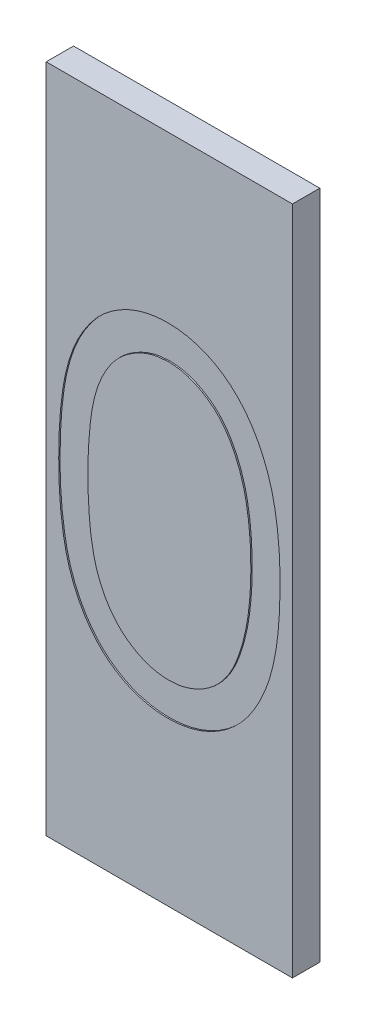
from build123d import *

# Parameters (mm, degrees)
SKETCH_1_W          = 18
SKETCH_1_H          = 49
EXTRUDE_1_DEPTH     = 2
CUT_EXTRUDE_1_DEPTH = 0.1


with BuildPart() as part:
    # ｽｹｯﾁ1 → ﾎﾞｽ - 押し出し1 (new body)
    with BuildSketch(Plane.XY):
        with Locations((9, 24.5)):
            Rectangle(SKETCH_1_W, SKETCH_1_H)
    extrude(amount=EXTRUDE_1_DEPTH)

    # ｽｹｯﾁ2 → ｶｯﾄ - 押し出し1 (cut)
    with BuildSketch(Plane.XY.offset(2)):
        with BuildLine():
            add(Edge.make_bspline(
                [(0.915865385, 24.396709736), (0.91809708, 24.77837232), (0.922432179, 25.519757391), (0.970658757, 26.600060045), (1.05077314, 27.613522012), (1.160564909, 28.5601918), (1.29417331, 29.440313805), (1.472532246, 30.251535992), (1.675365778, 30.997612959), (1.910445811, 31.68097761), (2.175702018, 32.310836625), (2.464406542, 32.898836655), (2.788017018, 33.444088016), (3.128038515, 33.95529334), (3.498234931, 34.42408455), (3.888071345, 34.85708195), (4.312763039, 35.244278306), (4.757873149, 35.597018327), (5.227431594, 35.906237054), (5.708054019, 36.178602651), (6.203048578, 36.411283891), (6.713766716, 36.594234892), (7.235618047, 36.745347974), (7.77042684, 36.848687065), (8.31907612, 36.913708174), (8.689404274, 36.919924378), (8.877216046, 36.923076923)],
                knots=[0, 0, 0, 0, 1.646270934, 3.197905019, 4.663502075, 6.030701355, 7.308322542, 8.50163776, 9.611534131, 10.641858119, 11.616356847, 12.558055219, 13.465016945, 14.349605745, 15.204443733, 16.039544428, 16.859896111, 17.680448484, 18.487036065, 19.28249412, 20.06191084, 20.843045899, 21.620316918, 22.403196591, 23.190181807, 24, 24, 24, 24], degree=3))
            add(Edge.make_bspline(
                [(8.877216046, 36.923076923), (9.066596712, 36.919758038), (9.443215272, 36.913157819), (10.000022111, 36.84972171), (10.543965481, 36.744462819), (11.072726389, 36.595321902), (11.590648172, 36.410294174), (12.093679803, 36.178380038), (12.58494584, 35.908422029), (13.056639404, 35.59121315), (13.51393884, 35.237548021), (13.945611588, 34.837752006), (14.351696941, 34.395861952), (14.737291429, 33.916605699), (15.091455403, 33.390791104), (15.42873179, 32.8275635), (15.730620106, 32.217073152), (16.021368521, 31.569506041), (16.27233177, 30.866944362), (16.498661046, 30.113348402), (16.681534028, 29.299816881), (16.833861042, 28.43061814), (16.95186828, 27.502560085), (17.037815363, 26.517632117), (17.083216174, 25.475186245), (17.09176623, 24.762458735), (17.096153846, 24.396709736)],
                knots=[0, 0, 0, 0, 0.810914788, 1.612654377, 2.396697861, 3.181598691, 3.963628158, 4.749916497, 5.551656086, 6.361998678, 7.18212741, 8.025565596, 8.878627764, 9.750805457, 10.657531673, 11.591944965, 12.560506719, 13.57287815, 14.630710178, 15.753379473, 16.941251878, 18.199788006, 19.531962791, 20.947069417, 22.433333509, 24, 24, 24, 24], degree=3))
            add(Edge.make_bspline(
                [(17.096153846, 24.396709736), (17.091720744, 24.032556005), (17.083083026, 23.323017311), (17.038324324, 22.285261925), (16.950159351, 21.305560952), (16.839873538, 20.38156477), (16.687126808, 19.517119185), (16.499313088, 18.709232848), (16.290781427, 17.954416932), (16.033369703, 17.258855088), (15.751628977, 16.61284426), (15.445092732, 16.009590983), (15.116685522, 15.44376317), (14.758894239, 14.919889892), (14.377530838, 14.4342601), (13.964433025, 13.995445917), (13.531245652, 13.592874024), (13.072600465, 13.234654916), (12.593550447, 12.921113656), (12.103971728, 12.640712281), (11.595177637, 12.414611266), (11.078698441, 12.220471077), (10.547146522, 12.072150145), (10.001184471, 11.969594092), (9.443589365, 11.897667766), (9.06666086, 11.892180823), (8.877216046, 11.889423077)],
                knots=[0, 0, 0, 0, 1.561518951, 3.042555995, 4.452378317, 5.7783523, 7.031515105, 8.214008947, 9.334062868, 10.386615937, 11.391082383, 12.354592575, 13.286541444, 14.194233754, 15.072674879, 15.931287219, 16.775624067, 17.606195743, 18.42308326, 19.229000347, 20.022332153, 20.807536673, 21.593273796, 22.3848459, 23.188221202, 24, 24, 24, 24], degree=3))
            add(Edge.make_bspline(
                [(8.877216046, 11.889423077), (8.689409484, 11.89259596), (8.319091603, 11.898852265), (7.770367066, 11.963579617), (7.237766871, 12.067643665), (6.718662848, 12.213353061), (6.210391736, 12.391707572), (5.7198795, 12.624074598), (5.241672223, 12.891686746), (4.777045744, 13.196455595), (4.334730863, 13.545626332), (3.912238566, 13.931826225), (3.520182632, 14.364692648), (3.155279232, 14.837390661), (2.808473382, 15.34557147), (2.489458181, 15.896173437), (2.194381478, 16.487013341), (1.924664157, 17.121908411), (1.685527714, 17.810123188), (1.474292414, 18.559530992), (1.307508593, 19.376746302), (1.164749558, 20.255205532), (1.049603309, 21.198683523), (0.970992631, 22.207692478), (0.922406184, 23.281603631), (0.918085437, 24.018224774), (0.915865385, 24.396709736)],
                knots=[0, 0, 0, 0, 0.810891512, 1.598919785, 2.382837074, 3.152667961, 3.926044502, 4.706494248, 5.493654104, 6.291793342, 7.103789334, 7.925228297, 8.761435821, 9.622817696, 10.50288917, 11.416980706, 12.369136599, 13.353924996, 14.394355917, 15.514179734, 16.714354668, 17.994756427, 19.357759367, 20.818452758, 22.365282078, 24, 24, 24, 24], degree=3))
        make_face()
        with BuildLine():
            add(Edge.make_bspline(
                [(3.052884615, 24.40625), (3.053697282, 24.088191888), (3.055274508, 23.470903548), (3.096478302, 22.573898505), (3.152609344, 21.737261089), (3.22500817, 20.959928993), (3.332524659, 20.244533372), (3.452994055, 19.586153921), (3.599598021, 18.988274861), (3.773055197, 18.446793506), (3.970624767, 17.95252038), (4.186337875, 17.492590684), (4.418072436, 17.061571259), (4.6774188, 16.663333674), (4.959869498, 16.296579236), (5.259044707, 15.954816573), (5.586109968, 15.650037111), (6.03857293, 15.284502615), (6.635902515, 14.906774223), (7.388516684, 14.577848147), (8.161868109, 14.371138935), (8.68677215, 14.344851595), (8.948768029, 14.331730769)],
                knots=[0, 0, 0, 0, 1.459021318, 2.831673884, 4.118529203, 5.306027144, 6.411944654, 7.436330062, 8.375795394, 9.233974572, 10.042671642, 10.816086306, 11.563610507, 12.285937304, 12.993564865, 13.685989202, 14.367179055, 15.041617293, 16.353048772, 17.594441528, 18.799311195, 20, 20, 20, 20], degree=3))
            add(Edge.make_bspline(
                [(8.948768029, 14.331730769), (9.212458616, 14.342601385), (9.739295369, 14.364320173), (10.509009225, 14.573861583), (11.256247313, 14.890020414), (11.841843906, 15.263859692), (12.287359068, 15.619879219), (12.606562162, 15.923418165), (12.899537884, 16.263296477), (13.177409858, 16.630004187), (13.432265355, 17.030547338), (13.664016345, 17.462999859), (13.87549412, 17.928562659), (13.995978879, 18.253567491), (14.057579627, 18.419734075)],
                knots=[0, 0, 0, 0, 1.353760809, 2.704726607, 4.075137775, 5.516104923, 6.260822281, 7.007110065, 7.778089737, 8.566572457, 9.372053459, 10.217411131, 11.088608312, 12, 12, 12, 12], degree=3))
            add(Edge.make_bspline(
                [(14.057579627, 18.419734075), (14.129369333, 18.632207838), (14.275133224, 19.063620698), (14.462991902, 19.732844831), (14.610938279, 20.434992207), (14.744039035, 21.165866662), (14.834887505, 21.930858199), (14.90801102, 22.727599847), (14.951082301, 23.556692329), (14.956421411, 24.119993966), (14.959134615, 24.40625)],
                knots=[0, 0, 0, 0, 0.884706709, 1.796334032, 2.740027952, 3.714592787, 4.726048262, 5.777819803, 6.87074269, 8, 8, 8, 8], degree=3))
            add(Edge.make_bspline(
                [(14.959134615, 24.40625), (14.955391364, 24.692459734), (14.948068763, 25.252347159), (14.920078954, 26.07230121), (14.847800706, 26.851090797), (14.767524558, 27.592070977), (14.649161322, 28.291140001), (14.521541243, 28.954150114), (14.350082995, 29.572887479), (14.166932383, 30.157039276), (13.957311656, 30.699968729), (13.726563536, 31.204207168), (13.480126213, 31.672188956), (13.212458469, 32.102630112), (12.92673784, 32.497458663), (12.615423086, 32.848758316), (12.290862978, 33.167416974), (11.836267481, 33.531153381), (11.241129902, 33.902027595), (10.500590766, 34.243333926), (9.729945847, 34.439333202), (9.208972883, 34.46696718), (8.948768029, 34.480769231)],
                knots=[0, 0, 0, 0, 1.31362396, 2.569729283, 3.763502607, 4.902122613, 5.988968491, 7.01645872, 7.998833611, 8.933434873, 9.825090667, 10.667526885, 11.477055099, 12.250526234, 12.991942729, 13.710640831, 14.402115721, 15.076753259, 16.378508321, 17.609869233, 18.806226677, 20, 20, 20, 20], degree=3))
            add(Edge.make_bspline(
                [(8.948768029, 34.480769231), (8.685397751, 34.466948138), (8.158177396, 34.439280775), (7.379522561, 34.244064175), (6.633141169, 33.903797389), (6.039577359, 33.529924997), (5.584664812, 33.173837557), (5.264334344, 32.865047575), (4.963982708, 32.527275737), (4.687297106, 32.157148424), (4.428153947, 31.759375121), (4.190158129, 31.330826561), (3.975727725, 30.869331029), (3.777849006, 30.375279924), (3.603862716, 29.833845284), (3.46034843, 29.236702667), (3.327766873, 28.580417296), (3.233909775, 27.861147072), (3.150472437, 27.083620279), (3.096851123, 26.244894239), (3.055136675, 25.346384794), (3.053650337, 24.725904805), (3.052884615, 24.40625)],
                knots=[0, 0, 0, 0, 1.207732386, 2.417664972, 3.655092373, 4.956220595, 5.625982001, 6.301752483, 6.994047911, 7.697131622, 8.419323945, 9.170223765, 9.943494443, 10.752040957, 11.610060368, 12.549350801, 13.567764191, 14.679664412, 15.874934091, 17.154273443, 18.533957287, 20, 20, 20, 20], degree=3))
        make_face(mode=Mode.SUBTRACT)
    extrude(amount=-CUT_EXTRUDE_1_DEPTH, mode=Mode.SUBTRACT)


solid = part.part
